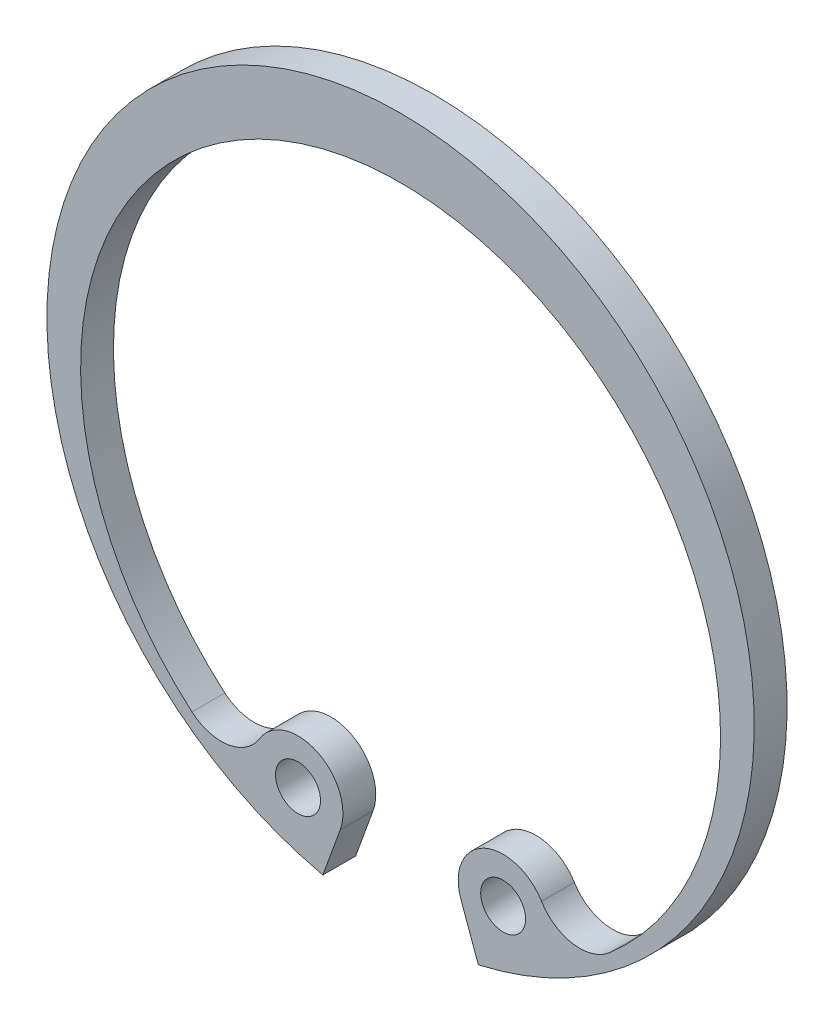
from build123d import *
from build123d.topology import SkipClean

# Parameters (mm, degrees)
SKETCH1_R                 = 10.5
EXTRUDE1_DEPTH            = 0.975
SKETCH34_R                = 0.666666667
F_056_250_SNAP_RING_DEPTH = 0.975
SKETCH35_R                = 10.5
CUT_EXTRUDE1_DEPTH        = 0.975


with BuildPart() as part:
    # Sketch1 → Extrude1 (new body)
    with BuildSketch(Plane.XY):
        Circle(SKETCH1_R)
    extrude(amount=EXTRUDE1_DEPTH)

    # Sketch34 → 056-250 Snap Ring (add)
    with SkipClean():  # the faces are left unmerged after this step: merging them gives an invalid solid
        with BuildSketch(Plane.XY.offset(0.975)):
            with BuildLine():
                Line((-1.791787382, -8.821301238), (-2.309216253, -10.242925378))
                ThreePointArc((-2.309216253, -10.242925378), (0, 10.5), (2.309216253, -10.242925378))
                Line((2.309216253, -10.242925378), (1.791787382, -8.821301238))
                ThreePointArc((1.791787382, -8.821301238), (2.46769193, -7.163264849), (4.184155828, -7.67285617))
                ThreePointArc((4.184155828, -7.67285617), (5.11466439, -8.297299138), (6.192760092, -7.991546198))
                ThreePointArc((6.192760092, -7.991546198), (0, 8.7126), (-6.192760092, -7.991546198))
                ThreePointArc((-6.192760092, -7.991546198), (-5.11466439, -8.297299138), (-4.184155828, -7.67285617))
                ThreePointArc((-4.184155828, -7.67285617), (-2.46769193, -7.163264849), (-1.791787382, -8.821301238))
            make_face()
            with Locations((3.044710876, -8.36527438)):
                Circle(SKETCH34_R, mode=Mode.SUBTRACT)
            with Locations((-3.044710876, -8.36527438)):
                Circle(SKETCH34_R, mode=Mode.SUBTRACT)
        extrude(amount=F_056_250_SNAP_RING_DEPTH)

    # Sketch35 → Cut-Extrude1 (cut)
    with BuildSketch(Plane(origin=(0, 0, 0), x_dir=(-1, 0, 0), z_dir=(0, 0, -1))):
        Circle(SKETCH35_R)
    extrude(amount=-CUT_EXTRUDE1_DEPTH, mode=Mode.SUBTRACT)


solid = part.part
